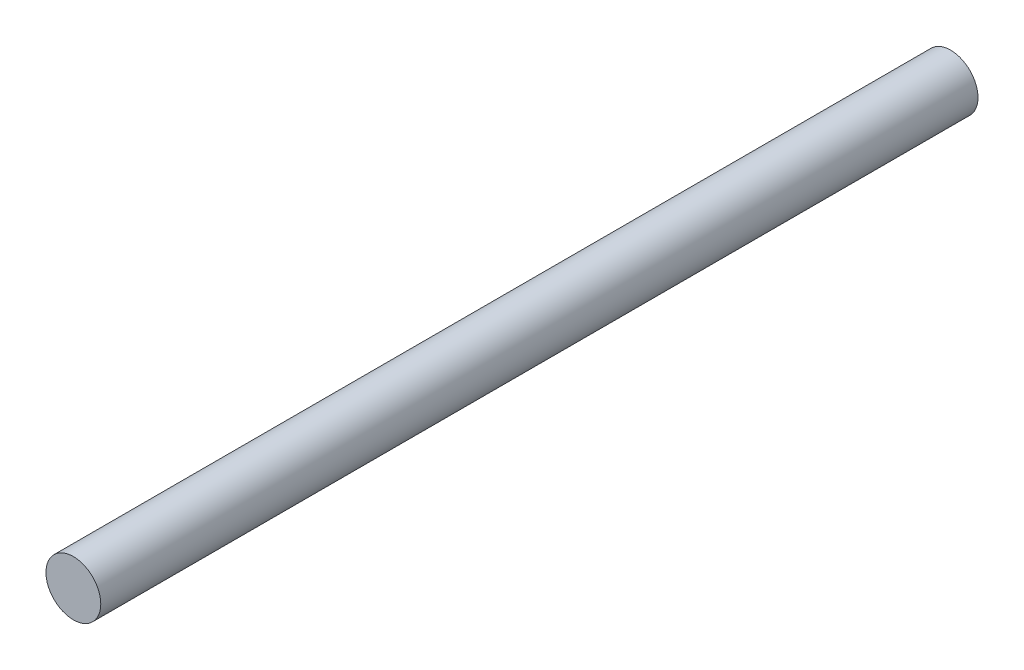
from build123d import *

# Parameters (mm, degrees)
BOSS_EXTRU_1_DEPTH      = 70
BOSS_EXTRU_1_DEPTH_BACK = 90
ESQUISSE1_R             = 5


with BuildPart() as part:
    # Esquisse1 → Boss.-Extru.1 (new, two sides: drawn at the far end of the back side and taken through both)
    with BuildSketch(Plane.XY.offset(-BOSS_EXTRU_1_DEPTH_BACK)):
        Circle(ESQUISSE1_R)
    extrude(amount=BOSS_EXTRU_1_DEPTH + BOSS_EXTRU_1_DEPTH_BACK)


solid = part.part
